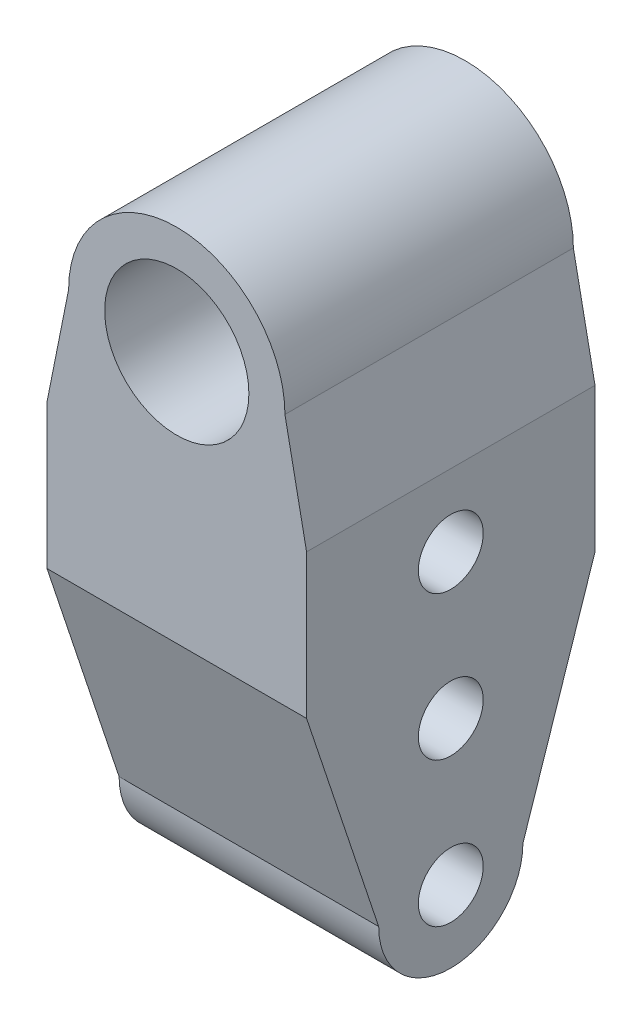
from build123d import *

# Parameters (mm, degrees)
SKETCH_1_R               = 10
EXTRUDE_1_DEPTH          = 20
SKETCH_2_R               = 4.5
CUT_EXTRUDE_1_DEPTH      = 20
CUT_EXTRUDE_2_DEPTH      = 86.562842403
CUT_EXTRUDE_2_DEPTH_BACK = 86.562842403


with BuildPart() as part:
    # 草图1 → 凸台-拉伸1 (new, symmetric)
    with BuildSketch(Plane.XY):
        with BuildLine():
            Line((0, -75), (18, -75))
            Line((18, -75), (18, -15))
            Line((18, -15), (15, 0))
            ThreePointArc((15, 0), (0, 15), (-15, 0))
            Line((-15, 0), (-18, -15))
            Line((-18, -15), (-18, -75))
            Line((-18, -75), (0, -75))
        make_face()
        Circle(SKETCH_1_R, mode=Mode.SUBTRACT)
    extrude(amount=EXTRUDE_1_DEPTH, both=True)

    # 草图2 → 切除-拉伸1 (cut, symmetric)
    with BuildSketch(Plane(origin=(0, 0, 0), x_dir=(0, 0, -1), z_dir=(1, 0, 0))):
        with Locations((0, -45)):
            Circle(SKETCH_2_R)
        with Locations((0, -25)):
            Circle(SKETCH_2_R)
        with Locations((0, -65)):
            Circle(SKETCH_2_R)
    extrude(amount=CUT_EXTRUDE_1_DEPTH, both=True, mode=Mode.SUBTRACT)

    # 草图7 → 切除-拉伸2 (cut, two sides: drawn at the far end of the back side and taken through both)
    with BuildSketch(Plane(origin=(18, 0, 0), x_dir=(0, 0, -1), z_dir=(1, 0, 0)).offset(-CUT_EXTRUDE_2_DEPTH_BACK)):
        with BuildLine():
            Line((-10, -65), (-20, -35))
            Line((-20, -35), (-20, -75))
            Line((-20, -75), (0, -75))
            ThreePointArc((0, -75), (-7.071067812, -72.071067812), (-10, -65))
        make_face()
        with BuildLine():
            ThreePointArc((10, -65), (7.071067812, -72.071067812), (0, -75))
            Line((0, -75), (20, -75))
            Line((20, -75), (20, -35))
            Line((20, -35), (10, -65))
        make_face()
    extrude(amount=CUT_EXTRUDE_2_DEPTH + CUT_EXTRUDE_2_DEPTH_BACK, mode=Mode.SUBTRACT)


solid = part.part
